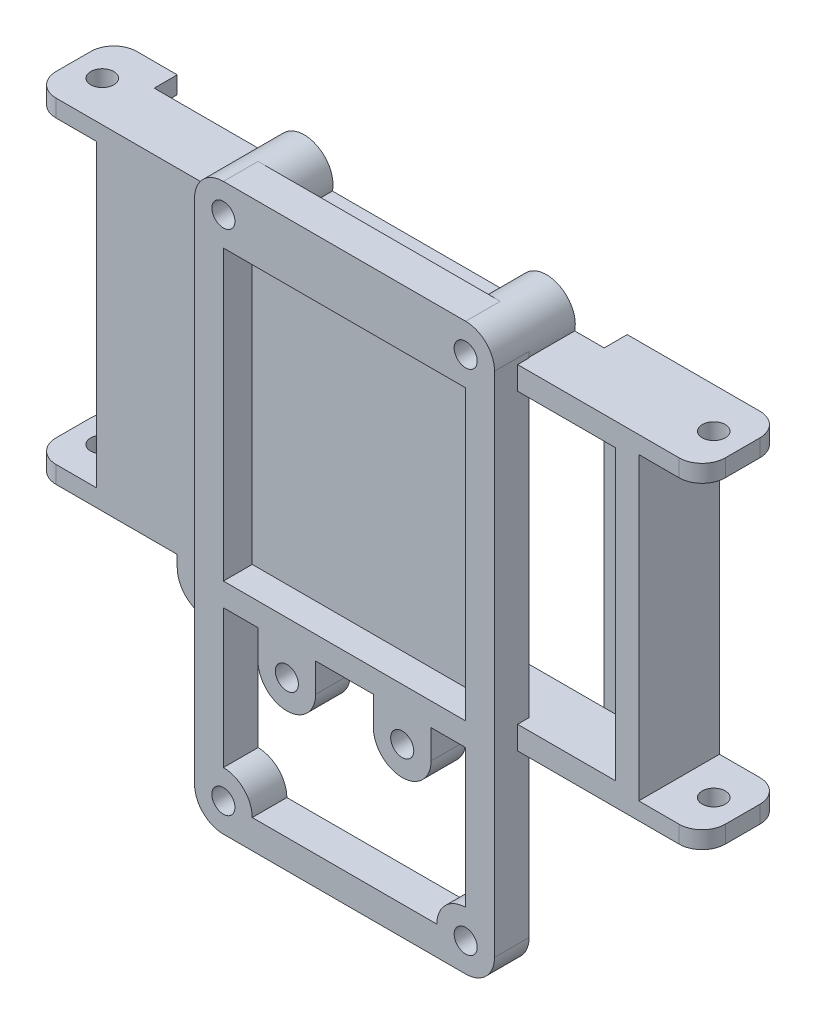
from build123d import *

# Parameters (mm, degrees)
SKETCH1_R                        = 1
ESP_BRACKET_DEPTH                = 3
SKETCH2_R                        = 1
LORA_HOLDER_SIDES_DEPTH          = 4
SKETCH9_W                        = 21
SKETCH9_H                        = 27
LORA_BACKING_ADD_MPU_HOLE_DEPTH  = 0.5
SKETCH4_W                        = 8
SKETCH4_H                        = 29
LORA_CONNECTOR_COVER_DEPTH       = 2
SKETCH6_W                        = 10.5
SKETCH6_H                        = 29
OTHER_SIDE_LORA_COVER_DEPTH      = 1
LORA_CLAMP_THIRD_SCREWHOLE_REACH = 54.569
SKETCH7_R                        = 1
SKETCH10_R                       = 1
BAROMETER_MOUNT_DEPTH            = 3
ALL_TABS_EXTRUDE_SIDEWAYS_REACH  = 54.872
SKETCH11_W                       = 5.5
SKETCH11_H                       = 1.5
SCREWHOLE_CUT_DEPTH              = 56.118055118
SCREWHOLE_CUT_DEPTH_BACK         = 56.118055118
SKETCH14_R                       = 1
SCREWHOLE_TAB_FILLETS_R          = 2


with BuildPart() as part:
    # Sketch1 → ESP Bracket (new body)
    with BuildSketch(Plane.XY):
        with BuildLine():
            Line((-13, 44), (-13, 0))
            ThreePointArc((-13, 0), (-12.267766953, -1.767766953), (-10.5, -2.5))
            Line((-10.5, -2.5), (10.5, -2.5))
            ThreePointArc((10.5, -2.5), (12.267766953, -1.767766953), (13, 0))
            Line((13, 0), (13, 44))
            ThreePointArc((13, 44), (12.267766953, 45.767766953), (10.5, 46.5))
            Line((10.5, 46.5), (-10.5, 46.5))
            ThreePointArc((-10.5, 46.5), (-12.267766953, 45.767766953), (-13, 44))
        make_face()
        with Locations((-10.5, 44)):
            Circle(SKETCH1_R, mode=Mode.SUBTRACT)
        with Locations((10.5, 44)):
            Circle(SKETCH1_R, mode=Mode.SUBTRACT)
        with Locations((10.5, 0)):
            Circle(SKETCH1_R, mode=Mode.SUBTRACT)
        with Locations((-10.5, 0)):
            Circle(SKETCH1_R, mode=Mode.SUBTRACT)
        with BuildLine():
            Line((-10.5, 41.5), (-10.5, 2.5))
            ThreePointArc((-10.5, 2.5), (-8.732233047, 1.767766953), (-8, 0))
            Line((-8, 0), (8, 0))
            ThreePointArc((8, 0), (8.732233047, 1.767766953), (10.5, 2.5))
            Line((10.5, 2.5), (10.5, 41.5))
            Line((10.5, 41.5), (-10.5, 41.5))
        make_face(mode=Mode.SUBTRACT)
    extrude(amount=-ESP_BRACKET_DEPTH)

    # Sketch2 → LoRa Holder Sides (add)
    with BuildSketch(Plane(origin=(0, 0, -3), x_dir=(-1, 0, 0), z_dir=(0, 0, -1))):
        with BuildLine():
            Line((-8.050510257, 43.5), (8.050510257, 43.5))
            ThreePointArc((8.050510257, 43.5), (10.5, 46.5), (12.949489743, 43.5))
            Line((12.949489743, 43.5), (23.5, 43.5))
            Line((23.5, 43.5), (23.5, 26.5))
            Line((23.5, 26.5), (21.5, 26.5))
            Line((21.5, 26.5), (21.5, 41.5))
            Line((21.5, 41.5), (-21.5, 41.5))
            Line((-21.5, 41.5), (-21.5, 16.5))
            Line((-21.5, 16.5), (21.5, 16.5))
            Line((21.5, 16.5), (21.5, 18))
            Line((21.5, 18), (23.5, 18))
            Line((23.5, 18), (23.5, 16.5))
            Line((23.5, 16.5), (23.5, 14.5))
            Line((23.5, 14.5), (-23.5, 14.5))
            Line((-23.5, 14.5), (-23.5, 43.5))
            Line((-23.5, 43.5), (-12.949489743, 43.5))
            ThreePointArc((-12.949489743, 43.5), (-10.5, 46.5), (-8.050510257, 43.5))
        make_face()
        with Locations(Location((-10.5, 44, 0), (0, 0, 180))):
            Circle(SKETCH2_R, mode=Mode.SUBTRACT)
        with Locations(Location((10.5, 44, 0), (0, 0, 180))):
            Circle(SKETCH2_R, mode=Mode.SUBTRACT)
    extrude(amount=LORA_HOLDER_SIDES_DEPTH)

    # Sketch9 → LoRa Backing (ADD MPU HOLE) (add)
    with BuildSketch(Plane.XY.offset(-3)):
        with Locations((0, 28)):
            Rectangle(SKETCH9_W, SKETCH9_H)
    extrude(amount=LORA_BACKING_ADD_MPU_HOLE_DEPTH)

    # Sketch4 → LoRa Connector Cover (add)
    with BuildSketch(Plane(origin=(0, 0, -7), x_dir=(-1, 0, 0), z_dir=(0, 0, -1))):
        with Locations((-19.5, 29)):
            Rectangle(SKETCH4_W, SKETCH4_H)
    extrude(amount=LORA_CONNECTOR_COVER_DEPTH)

    # Sketch6 → Other Side LoRa Cover (add)
    with BuildSketch(Plane.XY.offset(-3)):
        with Locations((-18.25, 29)):
            Rectangle(SKETCH6_W, SKETCH6_H)
        Polygon((13, 16.5), (13, 14.5), (23.5, 14.5), (23.5, 43.5), (13, 43.5), (13, 41.5), (21.5, 41.5), (21.5, 16.5), align=None)
    extrude(amount=OTHER_SIDE_LORA_COVER_DEPTH)

    # LoRa Clamp Third Screwhole: up to this face of the body (flat: up to its plane)
    lora_clamp_third_screwhole_end = Plane(part.part.faces().sort_by_distance((-18.25, 29, -2))[0])
    # Sketch7 → LoRa Clamp Third Screwhole (add, up to the picked face)
    with BuildSketch(Plane(origin=(0, 0, -7), x_dir=(-1, 0, 0), z_dir=(0, 0, -1)), mode=Mode.PRIVATE) as lora_clamp_third_screwhole_sk1:
        with BuildLine():
            Line((16.5, 16.5), (11.5, 16.5))
            Line((11.5, 16.5), (11.5, 13.5))
            ThreePointArc((11.5, 13.5), (14, 11), (16.5, 13.5))
            Line((16.5, 13.5), (16.5, 16.5))
        make_face()
        with Locations((14, 13.5)):
            Circle(SKETCH7_R, mode=Mode.SUBTRACT)
    lora_clamp_third_screwhole_tool1 = split(extrude(lora_clamp_third_screwhole_sk1.sketch, amount=-LORA_CLAMP_THIRD_SCREWHOLE_REACH, mode=Mode.PRIVATE), bisect_by=lora_clamp_third_screwhole_end, keep=Keep.BOTH, mode=Mode.PRIVATE)
    add(lora_clamp_third_screwhole_tool1.solids().sort_by(Axis((-14, 16.42567, -7), (0, 0, 1)))[0])

    # Sketch10 → Barometer Mount (add)
    with BuildSketch(Plane.XY):
        with BuildLine():
            Line((-10.5, 16.5), (10.5, 16.5))
            Line((10.5, 16.5), (10.5, 14.5))
            Line((10.5, 14.5), (7.5, 14.5))
            Line((7.5, 14.5), (7.5, 12))
            ThreePointArc((7.5, 12), (5, 9.5), (2.5, 12))
            Line((2.5, 12), (2.5, 14.5))
            Line((2.5, 14.5), (-2.5, 14.5))
            Line((-2.5, 14.5), (-2.5, 12))
            ThreePointArc((-2.5, 12), (-5, 9.5), (-7.5, 12))
            Line((-7.5, 12), (-7.5, 14.5))
            Line((-7.5, 14.5), (-10.5, 14.5))
            Line((-10.5, 14.5), (-10.5, 16.5))
        make_face()
        with Locations((-5, 12)):
            Circle(SKETCH10_R, mode=Mode.SUBTRACT)
        with Locations((5, 12)):
            Circle(SKETCH10_R, mode=Mode.SUBTRACT)
    extrude(amount=-BAROMETER_MOUNT_DEPTH)

    # All tabs extrude sideways: up to this face of the body (flat: up to its plane)
    all_tabs_extrude_sideways_end = Plane(part.part.faces().sort_by_distance((-18.166447268, 28.59721894, -2))[0])
    # Sketch11 → All tabs extrude sideways (add, up to the picked face)
    with BuildSketch(Plane(origin=(0, 0, -9), x_dir=(-1, 0, 0), z_dir=(0, 0, -1)), mode=Mode.PRIVATE) as all_tabs_extrude_sideways_sk1:
        with Locations((-26.25, 42.75)):
            Rectangle(SKETCH11_W, SKETCH11_H)
    all_tabs_extrude_sideways_tool1 = split(extrude(all_tabs_extrude_sideways_sk1.sketch, amount=-ALL_TABS_EXTRUDE_SIDEWAYS_REACH, mode=Mode.PRIVATE), bisect_by=all_tabs_extrude_sideways_end, keep=Keep.BOTH, mode=Mode.PRIVATE)
    # Sketch11 → All tabs extrude sideways (add, up to the picked face)
    with BuildSketch(Plane(origin=(0, 0, -9), x_dir=(-1, 0, 0), z_dir=(0, 0, -1)), mode=Mode.PRIVATE) as all_tabs_extrude_sideways_sk2:
        with Locations((-26.25, 15.25)):
            Rectangle(SKETCH11_W, SKETCH11_H)
    all_tabs_extrude_sideways_tool2 = split(extrude(all_tabs_extrude_sideways_sk2.sketch, amount=-ALL_TABS_EXTRUDE_SIDEWAYS_REACH, mode=Mode.PRIVATE), bisect_by=all_tabs_extrude_sideways_end, keep=Keep.BOTH, mode=Mode.PRIVATE)
    # Sketch11 → All tabs extrude sideways (add, up to the picked face)
    with BuildSketch(Plane(origin=(0, 0, -9), x_dir=(-1, 0, 0), z_dir=(0, 0, -1)), mode=Mode.PRIVATE) as all_tabs_extrude_sideways_sk3:
        with Locations((26.25, 15.25)):
            Rectangle(SKETCH11_W, SKETCH11_H)
    all_tabs_extrude_sideways_tool3 = split(extrude(all_tabs_extrude_sideways_sk3.sketch, amount=-ALL_TABS_EXTRUDE_SIDEWAYS_REACH, mode=Mode.PRIVATE), bisect_by=all_tabs_extrude_sideways_end, keep=Keep.BOTH, mode=Mode.PRIVATE)
    # Sketch11 → All tabs extrude sideways (add, up to the picked face)
    with BuildSketch(Plane(origin=(0, 0, -9), x_dir=(-1, 0, 0), z_dir=(0, 0, -1)), mode=Mode.PRIVATE) as all_tabs_extrude_sideways_sk4:
        with Locations((26.25, 42.75)):
            Rectangle(SKETCH11_W, SKETCH11_H)
    all_tabs_extrude_sideways_tool4 = split(extrude(all_tabs_extrude_sideways_sk4.sketch, amount=-ALL_TABS_EXTRUDE_SIDEWAYS_REACH, mode=Mode.PRIVATE), bisect_by=all_tabs_extrude_sideways_end, keep=Keep.BOTH, mode=Mode.PRIVATE)
    add(all_tabs_extrude_sideways_tool1.solids().sort_by(Axis((26.25, 42.75, -9), (0, 0, 1)))[0])
    add(all_tabs_extrude_sideways_tool2.solids().sort_by(Axis((26.25, 15.25, -9), (0, 0, 1)))[0])
    add(all_tabs_extrude_sideways_tool3.solids().sort_by(Axis((-26.25, 15.25, -9), (0, 0, 1)))[0])
    add(all_tabs_extrude_sideways_tool4.solids().sort_by(Axis((-26.25, 42.75, -9), (0, 0, 1)))[0])

    # Sketch14 → Screwhole cut (cut, two sides: drawn at the far end of the back side and taken through both)
    with BuildSketch(Plane(origin=(0, 43.5, 0), x_dir=(1, 0, 0), z_dir=(0, 1, 0)).offset(-SCREWHOLE_CUT_DEPTH_BACK)):
        with Locations(Location((-26.5, 5.5, 0), (0, 0, 90))):
            Circle(SKETCH14_R)
        with Locations(Location((26.5, 5.5, 0), (0, 0, 270))):
            Circle(SKETCH14_R)
    extrude(amount=SCREWHOLE_CUT_DEPTH + SCREWHOLE_CUT_DEPTH_BACK, mode=Mode.SUBTRACT)

    # Screwhole tab fillets
    screwhole_tab_fillets_edges = [part.edges().sort_by_distance(p)[0] for p in [
        (29, 42.75, -9),
        (29, 42.75, -2),
        (29, 15.25, -9),
        (29, 15.25, -2),
        (-29, 15.25, -9),
        (-29, 15.25, -2),
        (-29, 42.75, -9),
        (-29, 42.75, -2),
    ]]
    fillet(screwhole_tab_fillets_edges, radius=SCREWHOLE_TAB_FILLETS_R)


solid = part.part
